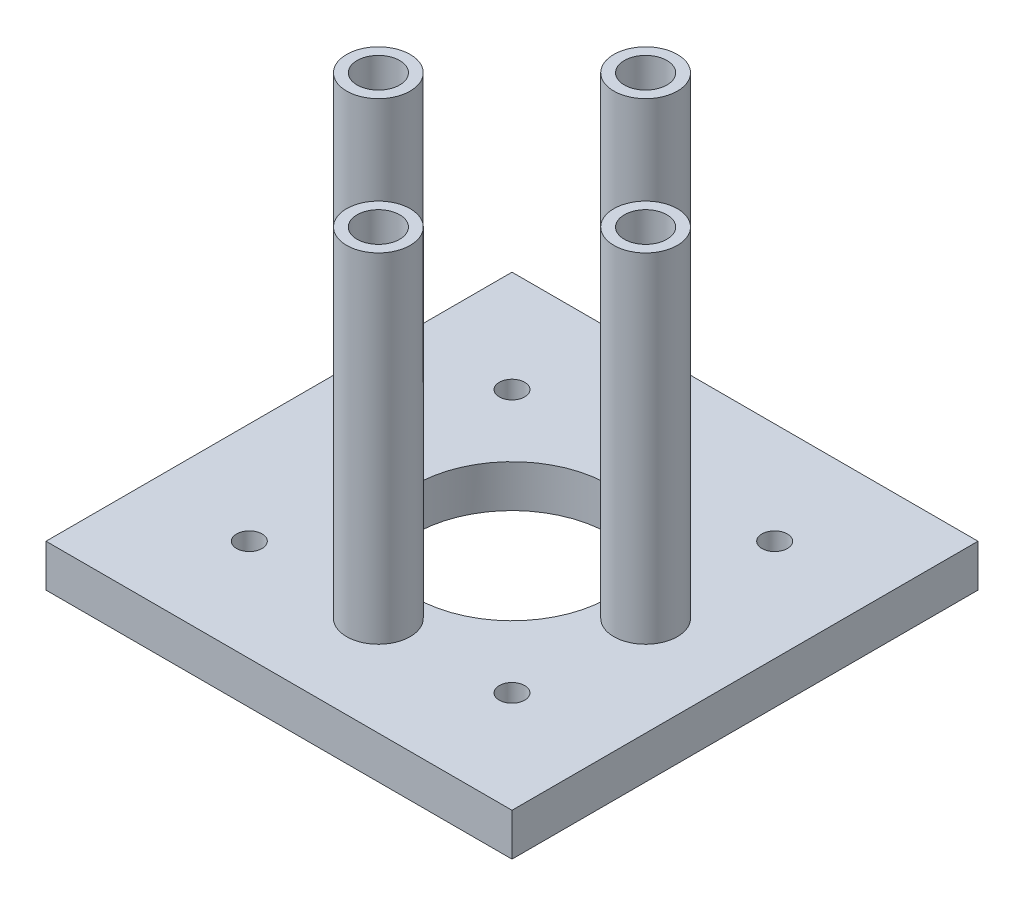
from build123d import *

# Parameters (mm, degrees)
SKETCH1_W           = 55
SKETCH1_H           = 55
SKETCH1_R           = 1.5
BOSS_EXTRUDE1_DEPTH = 5
SKETCH2_R           = 3.75
SKETCH2_R_2         = 2.51184584
BOSS_EXTRUDE2_DEPTH = 40
SKETCH3_R           = 11.5
CUT_EXTRUDE1_DEPTH  = 15


with BuildPart() as part:
    # Sketch1 → Boss-Extrude1 (new body)
    with BuildSketch(Plane(origin=(0, 0, 0), x_dir=(1, 0, 0), z_dir=(0, 1, 0))):
        Rectangle(SKETCH1_W, SKETCH1_H)
        with Locations(Location((-15.5, 15.5, 0), (0, 0, 270))):
            Circle(SKETCH1_R, mode=Mode.SUBTRACT)
        with Locations(Location((-15.5, -15.5, 0), (0, 0, 90))):
            Circle(SKETCH1_R, mode=Mode.SUBTRACT)
        with Locations(Location((15.5, -15.5, 0), (0, 0, 270))):
            Circle(SKETCH1_R, mode=Mode.SUBTRACT)
        with Locations(Location((15.5, 15.5, 0), (0, 0, 90))):
            Circle(SKETCH1_R, mode=Mode.SUBTRACT)
    extrude(amount=BOSS_EXTRUDE1_DEPTH)

    # Sketch2 → Boss-Extrude2 (add)
    # profile 1 of 4: a face of its own
    with BuildSketch(Plane(origin=(0, 5, 0), x_dir=(1, 0, 0), z_dir=(0, 1, 0))):
        with Locations(Location((-15.77, 0, 0), (0, 0, 90))):
            Circle(SKETCH2_R)
        with Locations(Location((-15.77, 0, 0), (0, 0, 270))):
            Circle(SKETCH2_R_2, mode=Mode.SUBTRACT)
    # profile 2 of 4: a face of its own
    with BuildSketch(Plane(origin=(0, 5, 0), x_dir=(1, 0, 0), z_dir=(0, 1, 0))):
        with Locations(Location((15.77, 0, 0), (0, 0, 90))):
            Circle(SKETCH2_R)
        with Locations(Location((15.77, 0, 0), (0, 0, 90))):
            Circle(SKETCH2_R_2, mode=Mode.SUBTRACT)
    # profile 3 of 4: a face of its own
    with BuildSketch(Plane(origin=(0, 5, 0), x_dir=(1, 0, 0), z_dir=(0, 1, 0))):
        with Locations(Location((0, -15.77, 0), (0, 0, 90))):
            Circle(SKETCH2_R)
        with Locations(Location((0, -15.77, 0), (0, 0, 270))):
            Circle(SKETCH2_R_2, mode=Mode.SUBTRACT)
    # profile 4 of 4: a face of its own
    with BuildSketch(Plane(origin=(0, 5, 0), x_dir=(1, 0, 0), z_dir=(0, 1, 0))):
        with Locations(Location((0, 15.77, 0), (0, 0, 90))):
            Circle(SKETCH2_R)
        with Locations(Location((0, 15.77, 0), (0, 0, 90))):
            Circle(SKETCH2_R_2, mode=Mode.SUBTRACT)
    extrude(amount=BOSS_EXTRUDE2_DEPTH)

    # Sketch3 → Cut-Extrude1 (cut)
    with BuildSketch(Plane(origin=(0, 5, 0), x_dir=(1, 0, 0), z_dir=(0, 1, 0))):
        with Locations(Location((0, 0, 0), (0, 0, 270))):
            Circle(SKETCH3_R)
    extrude(amount=-CUT_EXTRUDE1_DEPTH, mode=Mode.SUBTRACT)


solid = part.part
